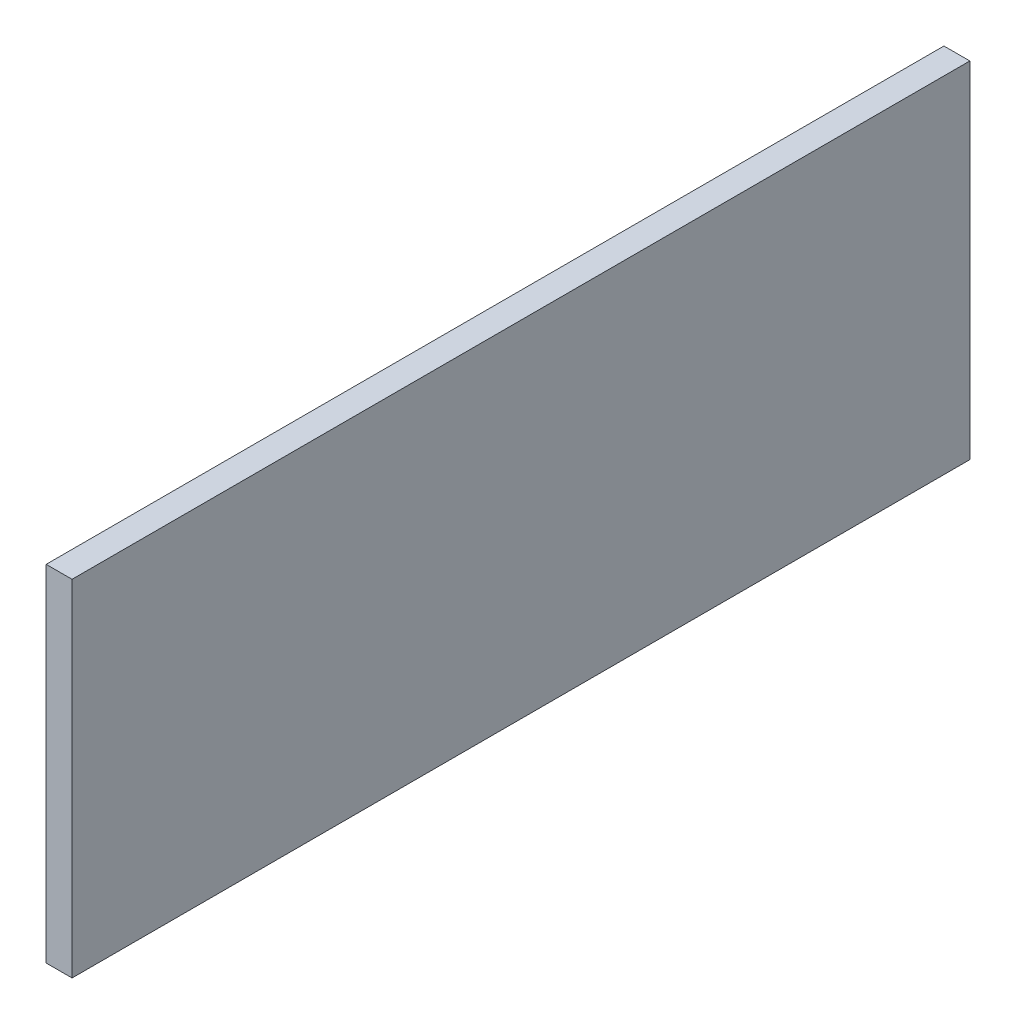
from build123d import *

# Parameters (mm, degrees)
SKETCH1_W           = 520
SKETCH1_H           = 200
BOSS_EXTRUDE1_DEPTH = 15


with BuildPart() as part:
    # Sketch1 → Boss-Extrude1 (new body)
    with BuildSketch(Plane(origin=(0, 0, 0), x_dir=(0, 0, -1), z_dir=(1, 0, 0))):
        with Locations((0, -100)):
            Rectangle(SKETCH1_W, SKETCH1_H)
    extrude(amount=BOSS_EXTRUDE1_DEPTH)


solid = part.part
